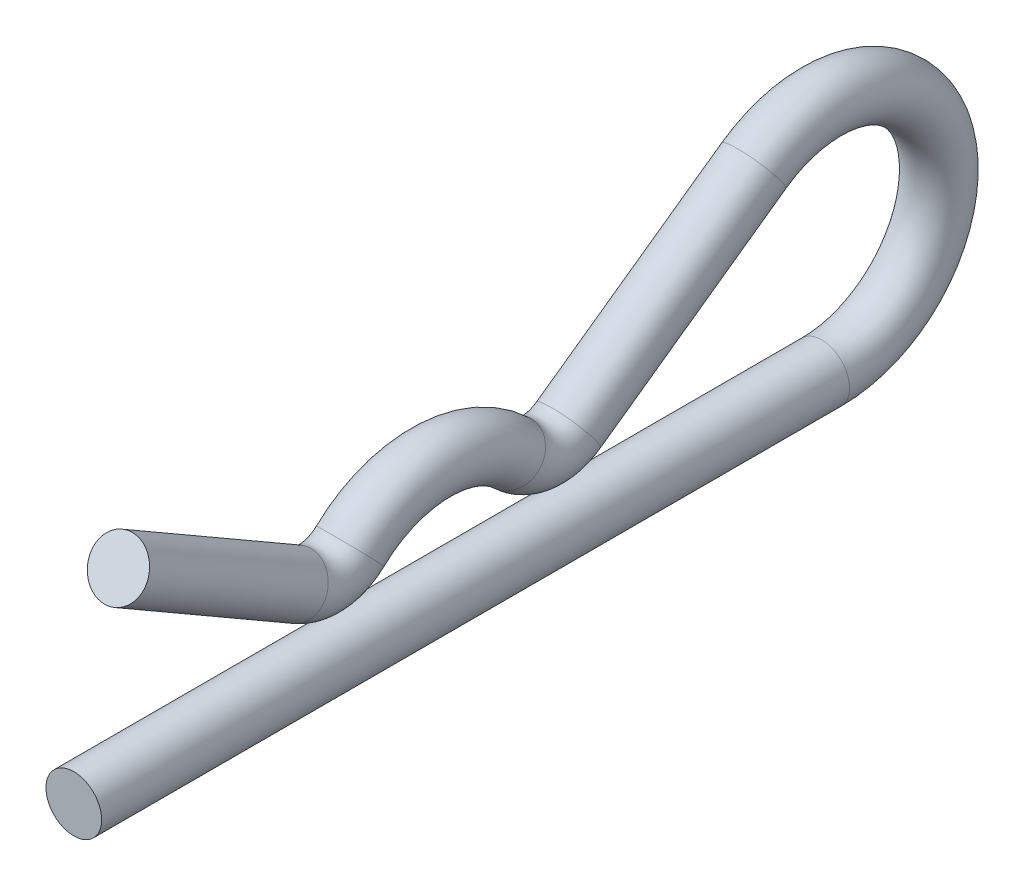
from build123d import *

# Parameters (mm, degrees)
SKETCH3_R = 0.9906


with BuildPart() as part:
    # Sweep1: sweep along a path in Sketch4
    with BuildLine(Plane(origin=(0, 0, 0), x_dir=(0, 0, -1), z_dir=(1, 0, 0))) as sweep1_path:
        Line((-14.2875, 2.291725528), (-7.936864949, -1.374815329))
        ThreePointArc((-7.936864949, -1.374815329), (-6.955022883, -1.576317742), (-6.048160493, -1.149448124))
        ThreePointArc((-6.048160493, -1.149448124), (-3.175, 0), (-0.301839507, -1.149448124))
        ThreePointArc((-0.301839507, -1.149448124), (0.679813066, -1.583451589), (1.71325761, -1.293635858))
        Line((1.71325761, -1.293635858), (8.304345659, 3.394500493))
        ThreePointArc((8.304345659, 3.394500493), (14.686945323, 1.267298723), (10.7188, -4.1656))
        Line((10.7188, -4.1656), (-15.875, -4.1656))
    # Sketch3 → Sweep1 (sweep)
    with BuildSketch(Plane.XY.offset(15.875)):
        with Locations((0, -4.1656)):
            Circle(SKETCH3_R)
    sweep(path=sweep1_path.line)


solid = part.part
